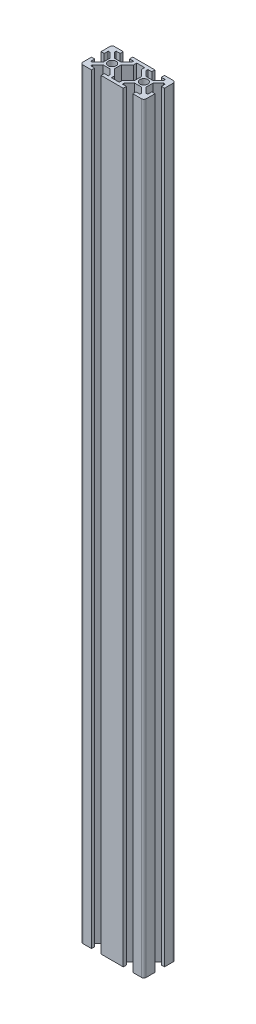
from build123d import *

# Parameters (mm, degrees)
SKETCH1_R           = 2.5
BOSS_EXTRUDE1_DEPTH = 240


with BuildPart() as part:
    # Sketch1 → Boss-Extrude1 (new, symmetric)
    with BuildSketch(Plane(origin=(0, 0, 0), x_dir=(1, 0, 0), z_dir=(0, 1, 0))):
        with BuildLine():
            Line((-7, -10), (-7, -8))
            Line((-7, -8), (-4.5, -8))
            Line((-4.5, -8), (-4.5, -6.914213562))
            Line((-4.5, -6.914213562), (-7.814213562, -3.6))
            Line((-7.814213562, -3.6), (-12.185786438, -3.6))
            Line((-12.185786438, -3.6), (-15.5, -6.914213562))
            Line((-15.5, -6.914213562), (-15.5, -8))
            Line((-15.5, -8), (-13, -8))
            Line((-13, -8), (-13, -10))
            Line((-13, -10), (-18.5, -10))
            ThreePointArc((-18.5, -10), (-19.560660172, -9.560660172), (-20, -8.5))
            Line((-20, -8.5), (-20, -3))
            Line((-20, -3), (-18, -3))
            Line((-18, -3), (-18, -5.5))
            Line((-18, -5.5), (-16.914213562, -5.5))
            Line((-16.914213562, -5.5), (-13.6, -2.185786438))
            Line((-13.6, -2.185786438), (-13.6, 2.185786438))
            Line((-13.6, 2.185786438), (-16.914213562, 5.5))
            Line((-16.914213562, 5.5), (-18, 5.5))
            Line((-18, 5.5), (-18, 3))
            Line((-18, 3), (-20, 3))
            Line((-20, 3), (-20, 8.5))
            ThreePointArc((-20, 8.5), (-19.560660172, 9.560660172), (-18.5, 10))
            Line((-18.5, 10), (-13, 10))
            Line((-13, 10), (-13, 8))
            Line((-13, 8), (-15.5, 8))
            Line((-15.5, 8), (-15.5, 6.914213562))
            Line((-15.5, 6.914213562), (-12.185786438, 3.6))
            Line((-12.185786438, 3.6), (-7.814213562, 3.6))
            Line((-7.814213562, 3.6), (-4.5, 6.914213562))
            Line((-4.5, 6.914213562), (-4.5, 8))
            Line((-4.5, 8), (-7, 8))
            Line((-7, 8), (-7, 10))
            Line((-7, 10), (7, 10))
            Line((7, 10), (7, 8))
            Line((7, 8), (4.5, 8))
            Line((4.5, 8), (4.5, 6.914213562))
            Line((4.5, 6.914213562), (7.814213562, 3.6))
            Line((7.814213562, 3.6), (12.185786438, 3.6))
            Line((12.185786438, 3.6), (15.5, 6.914213562))
            Line((15.5, 6.914213562), (15.5, 8))
            Line((15.5, 8), (13, 8))
            Line((13, 8), (13, 10))
            Line((13, 10), (18.5, 10))
            ThreePointArc((18.5, 10), (19.560660172, 9.560660172), (20, 8.5))
            Line((20, 8.5), (20, 3))
            Line((20, 3), (18, 3))
            Line((18, 3), (18, 5.5))
            Line((18, 5.5), (16.914213562, 5.5))
            Line((16.914213562, 5.5), (13.6, 2.185786438))
            Line((13.6, 2.185786438), (13.6, -2.185786438))
            Line((13.6, -2.185786438), (16.914213562, -5.5))
            Line((16.914213562, -5.5), (18, -5.5))
            Line((18, -5.5), (18, -3))
            Line((18, -3), (20, -3))
            Line((20, -3), (20, -8.5))
            ThreePointArc((20, -8.5), (19.560660172, -9.560660172), (18.5, -10))
            Line((18.5, -10), (13, -10))
            Line((13, -10), (13, -8))
            Line((13, -8), (15.5, -8))
            Line((15.5, -8), (15.5, -6.914213562))
            Line((15.5, -6.914213562), (12.185786438, -3.6))
            Line((12.185786438, -3.6), (7.814213562, -3.6))
            Line((7.814213562, -3.6), (4.5, -6.914213562))
            Line((4.5, -6.914213562), (4.5, -8))
            Line((4.5, -8), (7, -8))
            Line((7, -8), (7, -10))
            Line((7, -10), (-7, -10))
        make_face()
        with Locations((-10, 0)):
            Circle(SKETCH1_R, mode=Mode.SUBTRACT)
        with Locations((10, 0)):
            Circle(SKETCH1_R, mode=Mode.SUBTRACT)
        Polygon((-2.5, 8), (-2.5, 6.085786438), (-6.4, 2.185786438), (-6.4, -2.185786438), (-2.5, -6.085786438), (-2.5, -8), (2.5, -8), (2.5, -6.085786438), (6.4, -2.185786438), (6.4, 2.185786438), (2.5, 6.085786438), (2.5, 8), align=None, mode=Mode.SUBTRACT)
    extrude(amount=BOSS_EXTRUDE1_DEPTH, both=True)


solid = part.part
